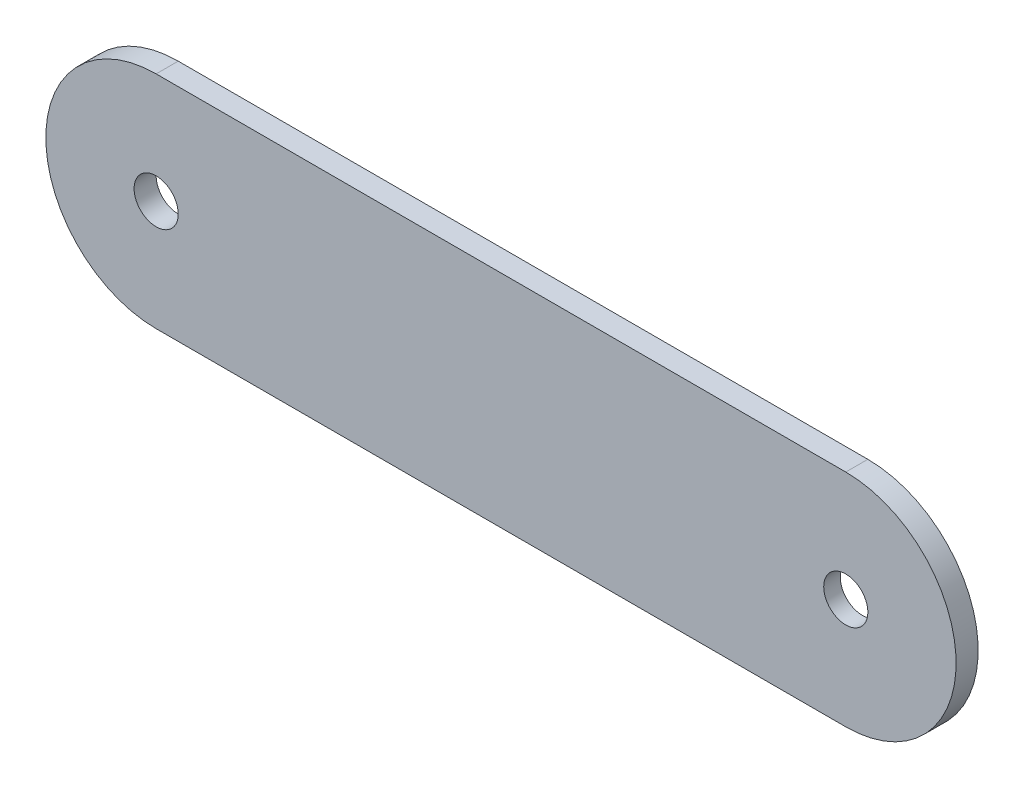
from build123d import *

# Parameters (mm, degrees)
SKETCH1_R           = 20
BOSS_EXTRUDE2_DEPTH = 20
SKETCH8_R           = 25
CUT_EXTRUDE6_DEPTH  = 5


with BuildPart() as part:
    # Sketch1 → Boss-Extrude2 (new body)
    with BuildSketch(Plane.XY):
        with BuildLine():
            Line((474.74714713, 99.423872527), (-150.25285287, 99.423872527))
            ThreePointArc((-150.25285287, 99.423872527), (-250.25285287, -0.576127473), (-150.25285287, -100.576127473))
            Line((-150.25285287, -100.576127473), (474.74714713, -100.576127473))
            ThreePointArc((474.74714713, -100.576127473), (574.74714713, -0.576127473), (474.74714713, 99.423872527))
        make_face()
        with Locations((-150.25285287, -0.576127473)):
            Circle(SKETCH1_R, mode=Mode.SUBTRACT)
        with Locations(Location((474.74714713, -0.576127473, 0), (0, 0, 180))):
            Circle(SKETCH1_R, mode=Mode.SUBTRACT)
    extrude(amount=BOSS_EXTRUDE2_DEPTH)

    # Sketch8 → Cut-Extrude6 (cut)
    with BuildSketch(Plane.XY):
        with BuildLine():
            Line((-150.25285287, -95.576127473), (474.74714713, -95.576127473))
            ThreePointArc((474.74714713, -95.576127473), (569.74714713, -0.576127473), (474.74714713, 94.423872527))
            Line((474.74714713, 94.423872527), (-150.25285287, 94.423872527))
            ThreePointArc((-150.25285287, 94.423872527), (-245.25285287, -0.576127473), (-150.25285287, -95.576127473))
        make_face()
        with Locations((-150.25285287, -0.576127473)):
            Circle(SKETCH8_R, mode=Mode.SUBTRACT)
    extrude(amount=CUT_EXTRUDE6_DEPTH, mode=Mode.SUBTRACT)


solid = part.part
